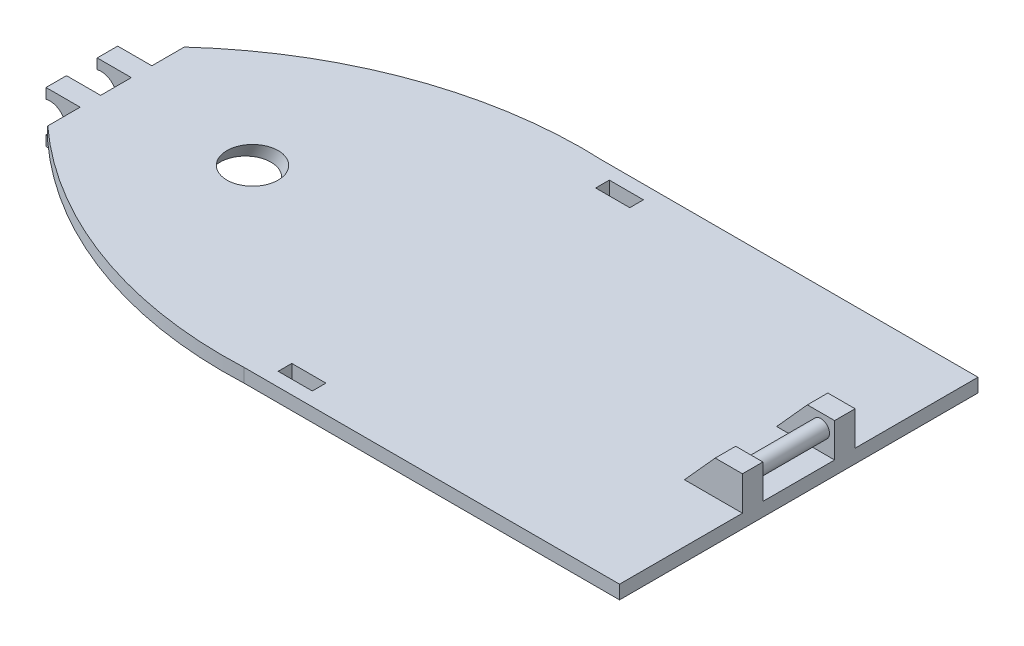
from build123d import *

# Parameters (mm, degrees)
BOSS_EXTRUDE1_DEPTH = 4
BOSS_EXTRUDE2_START = -45
BOSS_EXTRUDE2_DEPTH = 3
BOSS_EXTRUDE3_START = -39
BOSS_EXTRUDE3_DEPTH = 3
BOSS_EXTRUDE4_REACH = 221.731
SKETCH6_R           = 2.5
SKETCH7_W           = 10
SKETCH7_H           = 4
CUT_EXTRUDE1_DEPTH  = 10
SKETCH8_R           = 7.5


with BuildPart() as part:
    # Sketch1 → Boss-Extrude1 (new body)
    with BuildSketch(Plane(origin=(0, 0, 0), x_dir=(1, 0, 0), z_dir=(0, 1, 0))):
        with BuildLine():
            Line((-110, 0), (0, 0))
            Line((0, 0), (0, -105))
            Line((0, -105), (-110, -105))
            ThreePointArc((-110, -105), (-158.232963684, -97.702822508), (-200, -72.5))
            Line((-200, -72.5), (-200, -32.5))
            ThreePointArc((-200, -32.5), (-158.232963684, -7.297177492), (-110, 0))
        make_face()
    extrude(amount=BOSS_EXTRUDE1_DEPTH)

    # Sketch2 → Boss-Extrude2 (add, symmetric)
    with BuildSketch(Plane.XY.offset(105).offset(BOSS_EXTRUDE2_START)):
        with BuildLine():
            Line((-200, 4), (-210, 4))
            Line((-210, 4), (-210, 1))
            ThreePointArc((-210, 1), (-204.2, -3.5), (-210, -8))
            Line((-210, -8), (-210, -11))
            Line((-210, -11), (-200, -11))
            Line((-200, -11), (-188, 0))
            Line((-188, 0), (-200, 4))
        make_face()
    boss_extrude2 = extrude(amount=BOSS_EXTRUDE2_DEPTH, both=True)

    # Mirror1: Boss-Extrude2 across plane
    add(boss_extrude2.mirror(Plane.XY.offset(52.5)))

    # Sketch5 → Boss-Extrude3 (add, symmetric)
    with BuildSketch(Plane.XY.offset(105).offset(BOSS_EXTRUDE3_START)):
        Polygon((-16.979807258, 4), (-7.979807258, 14), (0, 14), (0, 4), align=None)
    boss_extrude3 = extrude(amount=BOSS_EXTRUDE3_DEPTH, both=True)

    # Mirror4: Boss-Extrude3 across plane
    add(boss_extrude3.mirror(Plane.XY.offset(52.5)))

    # Sketch6 → Boss-Extrude4 (add, up to next)
    with BuildSketch(Plane.XY.offset(42), mode=Mode.PRIVATE) as boss_extrude4_sk1:
        with Locations(Location((-4, 10, 0), (0, 0, 180))):
            Circle(SKETCH6_R)
    boss_extrude4_tool1 = extrude(boss_extrude4_sk1.sketch, amount=BOSS_EXTRUDE4_REACH, mode=Mode.PRIVATE) - part.part
    add(boss_extrude4_tool1.solids().sort_by_distance((-4, 10, 42))[0])

    # Sketch7 → Cut-Extrude1 (cut)
    with BuildSketch(Plane(origin=(0, 4, 0), x_dir=(1, 0, 0), z_dir=(0, 1, 0))):
        with Locations((-99, -99)):
            Rectangle(SKETCH7_W, SKETCH7_H)
    cut_extrude1 = extrude(amount=-CUT_EXTRUDE1_DEPTH, mode=Mode.SUBTRACT)

    # Mirror5: Cut-Extrude1 across plane
    add(cut_extrude1.mirror(Plane.XY.offset(52.5)), mode=Mode.SUBTRACT)

    # Cut-Sweep1: sweep along a path in Sketch9
    with BuildLine(Plane.XY.offset(52.5)) as cut_sweep1_path:
        Line((-160, 4), (-163.867437875, -3.466183031))
    # Sketch8 → Cut-Sweep1 (sweep, cut)
    with BuildSketch(Plane(origin=(0, 4, 0), x_dir=(1, 0, 0), z_dir=(0, 1, 0))):
        with Locations((-160, -52.5)):
            Circle(SKETCH8_R)
    sweep(path=cut_sweep1_path.line, mode=Mode.SUBTRACT)


solid = part.part
